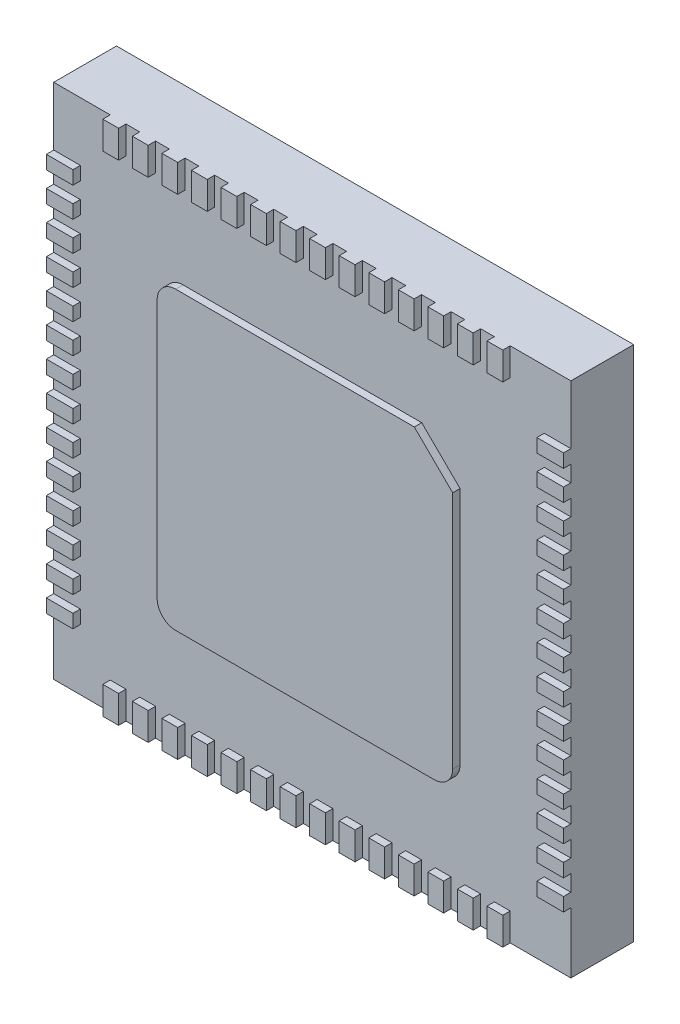
from build123d import *

# Parameters (mm, degrees)
PACKAGE_W               = 7
PACKAGE_H               = 7
BOSS_EXTRU_1_DEPTH      = 0.85
ESQUISSE2_W             = 0.213586618
ESQUISSE2_H             = 0.374942299
ESQUISSE2_W_2           = 0.360094548
ESQUISSE2_H_2           = 0.182510236
ESQUISSE2_W_3           = 0.360094549
BOSS_EXTRU_2_DEPTH      = 0.1
ESQUISSE3_R             = 0.166069215
ENL_V_MAT_EXTRU_1_DEPTH = 0.1
ENL_V_MAT_EXTRU_2_DEPTH = 0.02


with BuildPart() as part:
    # package → Boss.-Extru.1 (new body)
    with BuildSketch(Plane.XY):
        with Locations((26.809198807, 233.44048648)):
            Rectangle(PACKAGE_W, PACKAGE_H)
    extrude(amount=-BOSS_EXTRU_1_DEPTH)

    # Esquisse2 → Boss.-Extru.2 (add)
    with BuildSketch(Plane.XY):
        with BuildLine():
            Line((25.059198807, 231.44048648), (28.559198807, 231.44048648))
            ThreePointArc((28.559198807, 231.44048648), (28.735975502, 231.513709785), (28.809198807, 231.69048648))
            Line((28.809198807, 231.69048648), (28.809198807, 234.928046777))
            Line((28.809198807, 234.928046777), (28.290211106, 235.44048648))
            Line((28.290211106, 235.44048648), (25.059198807, 235.44048648))
            ThreePointArc((25.059198807, 235.44048648), (24.882422111, 235.367263175), (24.809198807, 235.19048648))
            Line((24.809198807, 235.19048648), (24.809198807, 231.69048648))
            ThreePointArc((24.809198807, 231.69048648), (24.882422111, 231.513709785), (25.059198807, 231.44048648))
        make_face()
        with Locations((24.180646365, 236.753015331)):
            Rectangle(ESQUISSE2_W, ESQUISSE2_H)
        with Locations((24.580646365, 236.753015331)):
            Rectangle(ESQUISSE2_W, ESQUISSE2_H)
        with Locations((24.980646365, 236.753015331)):
            Rectangle(ESQUISSE2_W, ESQUISSE2_H)
        with Locations((25.380646365, 236.753015331)):
            Rectangle(ESQUISSE2_W, ESQUISSE2_H)
        with Locations((25.780646365, 236.753015331)):
            Rectangle(ESQUISSE2_W, ESQUISSE2_H)
        with Locations((26.180646365, 236.753015331)):
            Rectangle(ESQUISSE2_W, ESQUISSE2_H)
        with Locations((26.580646365, 236.753015331)):
            Rectangle(ESQUISSE2_W, ESQUISSE2_H)
        with Locations((26.980646365, 236.753015331)):
            Rectangle(ESQUISSE2_W, ESQUISSE2_H)
        with Locations((27.380646365, 236.753015331)):
            Rectangle(ESQUISSE2_W, ESQUISSE2_H)
        with Locations((27.780646365, 236.753015331)):
            Rectangle(ESQUISSE2_W, ESQUISSE2_H)
        with Locations((28.180646365, 236.753015331)):
            Rectangle(ESQUISSE2_W, ESQUISSE2_H)
        with Locations((28.580646365, 236.753015331)):
            Rectangle(ESQUISSE2_W, ESQUISSE2_H)
        with Locations((28.980646365, 236.753015331)):
            Rectangle(ESQUISSE2_W, ESQUISSE2_H)
        with Locations((29.380646365, 236.753015331)):
            Rectangle(ESQUISSE2_W, ESQUISSE2_H)
        with Locations((23.489246081, 235.654646382)):
            Rectangle(ESQUISSE2_W_2, ESQUISSE2_H_2)
        with Locations((23.489246081, 236.054646382)):
            Rectangle(ESQUISSE2_W_2, ESQUISSE2_H_2)
        with Locations((23.489246081, 235.254646382)):
            Rectangle(ESQUISSE2_W_2, ESQUISSE2_H_2)
        with Locations((23.489246081, 234.854646382)):
            Rectangle(ESQUISSE2_W_2, ESQUISSE2_H_2)
        with Locations((23.489246081, 234.454646382)):
            Rectangle(ESQUISSE2_W_2, ESQUISSE2_H_2)
        with Locations((23.489246081, 234.054646382)):
            Rectangle(ESQUISSE2_W_2, ESQUISSE2_H_2)
        with Locations((23.489246081, 233.654646382)):
            Rectangle(ESQUISSE2_W_2, ESQUISSE2_H_2)
        with Locations((23.489246081, 233.254646382)):
            Rectangle(ESQUISSE2_W_2, ESQUISSE2_H_2)
        with Locations((23.489246081, 232.854646382)):
            Rectangle(ESQUISSE2_W_2, ESQUISSE2_H_2)
        with Locations((23.489246081, 232.454646382)):
            Rectangle(ESQUISSE2_W_2, ESQUISSE2_H_2)
        with Locations((23.489246081, 232.054646382)):
            Rectangle(ESQUISSE2_W_2, ESQUISSE2_H_2)
        with Locations((23.489246081, 231.654646382)):
            Rectangle(ESQUISSE2_W_2, ESQUISSE2_H_2)
        with Locations((23.489246081, 231.254646382)):
            Rectangle(ESQUISSE2_W_2, ESQUISSE2_H_2)
        with Locations((23.489246081, 230.854646382)):
            Rectangle(ESQUISSE2_W_2, ESQUISSE2_H_2)
        with Locations((29.380646365, 230.12795763)):
            Rectangle(ESQUISSE2_W, ESQUISSE2_H)
        with Locations((28.980646365, 230.12795763)):
            Rectangle(ESQUISSE2_W, ESQUISSE2_H)
        with Locations((28.580646365, 230.12795763)):
            Rectangle(ESQUISSE2_W, ESQUISSE2_H)
        with Locations((28.180646365, 230.12795763)):
            Rectangle(ESQUISSE2_W, ESQUISSE2_H)
        with Locations((27.780646365, 230.12795763)):
            Rectangle(ESQUISSE2_W, ESQUISSE2_H)
        with Locations((27.380646365, 230.12795763)):
            Rectangle(ESQUISSE2_W, ESQUISSE2_H)
        with Locations((26.980646365, 230.12795763)):
            Rectangle(ESQUISSE2_W, ESQUISSE2_H)
        with Locations((26.580646365, 230.12795763)):
            Rectangle(ESQUISSE2_W, ESQUISSE2_H)
        with Locations((26.180646365, 230.12795763)):
            Rectangle(ESQUISSE2_W, ESQUISSE2_H)
        with Locations((25.780646365, 230.12795763)):
            Rectangle(ESQUISSE2_W, ESQUISSE2_H)
        with Locations((25.380646365, 230.12795763)):
            Rectangle(ESQUISSE2_W, ESQUISSE2_H)
        with Locations((24.980646365, 230.12795763)):
            Rectangle(ESQUISSE2_W, ESQUISSE2_H)
        with Locations((24.580646365, 230.12795763)):
            Rectangle(ESQUISSE2_W, ESQUISSE2_H)
        with Locations((24.180646365, 230.12795763)):
            Rectangle(ESQUISSE2_W, ESQUISSE2_H)
        with Locations((30.129151533, 230.854646382)):
            Rectangle(ESQUISSE2_W_3, ESQUISSE2_H_2)
        with Locations((30.129151533, 231.254646382)):
            Rectangle(ESQUISSE2_W_3, ESQUISSE2_H_2)
        with Locations((30.129151533, 231.654646382)):
            Rectangle(ESQUISSE2_W_3, ESQUISSE2_H_2)
        with Locations((30.129151533, 232.054646382)):
            Rectangle(ESQUISSE2_W_3, ESQUISSE2_H_2)
        with Locations((30.129151533, 232.454646382)):
            Rectangle(ESQUISSE2_W_3, ESQUISSE2_H_2)
        with Locations((30.129151533, 232.854646382)):
            Rectangle(ESQUISSE2_W_3, ESQUISSE2_H_2)
        with Locations((30.129151533, 233.254646382)):
            Rectangle(ESQUISSE2_W_3, ESQUISSE2_H_2)
        with Locations((30.129151533, 233.654646382)):
            Rectangle(ESQUISSE2_W_3, ESQUISSE2_H_2)
        with Locations((30.129151533, 234.054646382)):
            Rectangle(ESQUISSE2_W_3, ESQUISSE2_H_2)
        with Locations((30.129151533, 234.454646382)):
            Rectangle(ESQUISSE2_W_3, ESQUISSE2_H_2)
        with Locations((30.129151533, 234.854646382)):
            Rectangle(ESQUISSE2_W_3, ESQUISSE2_H_2)
        with Locations((30.129151533, 235.254646382)):
            Rectangle(ESQUISSE2_W_3, ESQUISSE2_H_2)
        with Locations((30.129151533, 235.654646382)):
            Rectangle(ESQUISSE2_W_3, ESQUISSE2_H_2)
        with Locations((30.129151533, 236.054646382)):
            Rectangle(ESQUISSE2_W_3, ESQUISSE2_H_2)
    extrude(amount=BOSS_EXTRU_2_DEPTH)

    # Esquisse3 → Enlèv. mat.-Extru.1 (cut)
    with BuildSketch(Plane(origin=(0, 0, -0.85), x_dir=(-1, 0, 0), z_dir=(0, 0, -1))):
        with Locations((-29.974611492, 236.581266458)):
            Circle(ESQUISSE3_R)
    extrude(amount=-ENL_V_MAT_EXTRU_1_DEPTH, mode=Mode.SUBTRACT)

    # Esquisse4 → Enlèv. mat.-Extru.2 (cut)
    # profile 1 of 12: a face of its own
    with BuildSketch(Plane(origin=(-0.370356703, 1.102355834, -0.85), x_dir=(-1, 0, 0), z_dir=(0, 0, -1))):
        Polygon((-28.682895901, 230.452000635), (-28.686659901, 230.484713635), (-28.838331901, 230.480821635), (-28.990003901, 230.476927635), (-28.990003901, 230.596414635), (-28.990003901, 230.715902635), (-28.856175901, 230.719267635), (-28.722347901, 230.722633635), (-28.722347901, 230.752370635), (-28.722347901, 230.782109635), (-28.856175901, 230.785472635), (-28.990003901, 230.788837635), (-28.990003901, 230.901457635), (-28.990003901, 231.014078635), (-28.841305901, 231.014078635), (-28.692607901, 231.014078635), (-28.692607901, 231.043818635), (-28.692607901, 231.073557635), (-28.876993901, 231.073557635), (-29.061378901, 231.073557635), (-29.061378901, 230.746422635), (-29.061378901, 230.419287635), (-28.870255901, 230.419287635), (-28.679131901, 230.419287635), align=None)
    # profile 2 of 12: a face of its own
    with BuildSketch(Plane(origin=(-0.370356703, 1.102355834, -0.85), x_dir=(-1, 0, 0), z_dir=(0, 0, -1))):
        with BuildLine():
            Line((-28.038336901, 230.556089635), (-28.038336901, 230.692890635))
            Line((-28.038336901, 230.692890635), (-27.936045901, 230.692890635))
            add(Edge.make_bspline(
                [(-27.936045901, 230.692890635), (-27.765671901, 230.692890635), (-27.699306901, 230.744596635), (-27.699384901, 230.877275635)],
                knots=[0, 0, 0, 0, 1, 1, 1, 1], degree=3))
            add(Edge.make_bspline(
                [(-27.699384901, 230.877275635), (-27.699473901, 230.963355635), (-27.727885901, 231.019005635), (-27.788523901, 231.051635635)],
                knots=[0, 0, 0, 0, 1, 1, 1, 1], degree=3))
            add(Edge.make_bspline(
                [(-27.788523901, 231.051635635), (-27.823602901, 231.070510635), (-27.851561901, 231.073534635), (-27.966063901, 231.070822635)],
                knots=[0, 0, 0, 0, 1, 1, 1, 1], degree=3))
            Line((-27.966063901, 231.070822635), (-28.101966901, 231.067608635))
            Line((-28.101966901, 231.067608635), (-28.099929901, 230.746420635))
            add(Edge.make_bspline(
                [(-28.099929901, 230.746420635), (-28.098817901, 230.569767635), (-28.097865901, 230.423895635), (-28.097865901, 230.422259635)],
                knots=[0, 0, 0, 0, 1, 1, 1, 1], degree=3))
            add(Edge.make_bspline(
                [(-28.097865901, 230.422259635), (-28.097865901, 230.420618635), (-28.084442901, 230.419285635), (-28.068085901, 230.419285635)],
                knots=[0, 0, 0, 0, 1, 1, 1, 1], degree=3))
            Line((-28.068085901, 230.419285635), (-28.038346901, 230.419285635))
            Line((-28.038346901, 230.419285635), (-28.038336901, 230.556089635))
        make_face()
        with BuildLine():
            Line((-28.038336901, 230.883224635), (-28.038336901, 231.014076635))
            Line((-28.038336901, 231.014076635), (-27.948527901, 231.014076635))
            add(Edge.make_bspline(
                [(-27.948527901, 231.014076635), (-27.816620901, 231.014076635), (-27.764732901, 230.977134635), (-27.764732901, 230.883222635)],
                knots=[0, 0, 0, 0, 1, 1, 1, 1], degree=3))
            add(Edge.make_bspline(
                [(-27.764732901, 230.883222635), (-27.764732901, 230.789310635), (-27.816620901, 230.752368635), (-27.948527901, 230.752368635)],
                knots=[0, 0, 0, 0, 1, 1, 1, 1], degree=3))
            Line((-27.948527901, 230.752368635), (-28.038336901, 230.752368635))
            Line((-28.038336901, 230.752368635), (-28.038336901, 230.883224635))
        make_face(mode=Mode.SUBTRACT)
    # profile 3 of 12: a face of its own
    with BuildSketch(Plane(origin=(-0.370356703, 1.102355834, -0.85), x_dir=(-1, 0, 0), z_dir=(0, 0, -1))):
        with BuildLine():
            Line((-26.848753901, 230.452550635), (-26.848753901, 230.485813635))
            Line((-26.848753901, 230.485813635), (-26.961421901, 230.480884635))
            add(Edge.make_bspline(
                [(-26.961421901, 230.480884635), (-27.105904901, 230.474566635), (-27.117372901, 230.478476635), (-27.092930901, 230.525741635)],
                knots=[0, 0, 0, 0, 1, 1, 1, 1], degree=3))
            add(Edge.make_bspline(
                [(-27.092930901, 230.525741635), (-27.082831901, 230.545270635), (-27.034841901, 230.603731635), (-26.986284901, 230.655653635)],
                knots=[0, 0, 0, 0, 1, 1, 1, 1], degree=3))
            add(Edge.make_bspline(
                [(-26.986284901, 230.655653635), (-26.937727901, 230.707574635), (-26.886919901, 230.771775635), (-26.873377901, 230.798321635)],
                knots=[0, 0, 0, 0, 1, 1, 1, 1], degree=3))
            add(Edge.make_bspline(
                [(-26.873377901, 230.798321635), (-26.839982901, 230.863779635), (-26.840408901, 230.956132635), (-26.874382901, 231.011063635)],
                knots=[0, 0, 0, 0, 1, 1, 1, 1], degree=3))
            add(Edge.make_bspline(
                [(-26.874382901, 231.011063635), (-26.934701901, 231.108662635), (-27.096131901, 231.109470635), (-27.154897901, 231.012466635)],
                knots=[0, 0, 0, 0, 1, 1, 1, 1], degree=3))
            add(Edge.make_bspline(
                [(-27.154897901, 231.012466635), (-27.194417901, 230.947235635), (-27.198240901, 230.922146635), (-27.170894901, 230.907510635)],
                knots=[0, 0, 0, 0, 1, 1, 1, 1], degree=3))
            add(Edge.make_bspline(
                [(-27.170894901, 230.907510635), (-27.149762901, 230.896199635), (-27.143994901, 230.900337635), (-27.122700901, 230.942075635)],
                knots=[0, 0, 0, 0, 1, 1, 1, 1], degree=3))
            add(Edge.make_bspline(
                [(-27.122700901, 230.942075635), (-27.095079901, 230.996219635), (-27.068447901, 231.014075635), (-27.015319901, 231.014075635)],
                knots=[0, 0, 0, 0, 1, 1, 1, 1], degree=3))
            add(Edge.make_bspline(
                [(-27.015319901, 231.014075635), (-26.961995901, 231.014075635), (-26.935881901, 230.996306635), (-26.920438901, 230.949514635)],
                knots=[0, 0, 0, 0, 1, 1, 1, 1], degree=3))
            add(Edge.make_bspline(
                [(-26.920438901, 230.949514635), (-26.896851901, 230.878039635), (-26.921073901, 230.824643635), (-27.035422901, 230.695952635)],
                knots=[0, 0, 0, 0, 1, 1, 1, 1], degree=3))
            add(Edge.make_bspline(
                [(-27.035422901, 230.695952635), (-27.131392901, 230.587953635), (-27.193375901, 230.487724635), (-27.193640901, 230.440101635)],
                knots=[0, 0, 0, 0, 1, 1, 1, 1], degree=3))
            add(Edge.make_bspline(
                [(-27.193640901, 230.440101635), (-27.193748901, 230.421226635), (-27.177657901, 230.419284635), (-27.021267901, 230.419284635)],
                knots=[0, 0, 0, 0, 1, 1, 1, 1], degree=3))
            Line((-27.021267901, 230.419284635), (-26.848778901, 230.419284635))
            Line((-26.848778901, 230.419284635), (-26.848753901, 230.452550635))
        make_face()
    # profile 4 of 12: a face of its own
    with BuildSketch(Plane(origin=(-0.370356703, 1.102355834, -0.85), x_dir=(-1, 0, 0), z_dir=(0, 0, -1))):
        with BuildLine():
            Line((-26.398895901, 230.745900635), (-26.395130901, 230.776160635))
            Line((-26.395130901, 230.776160635), (-26.580305901, 230.776160635))
            Line((-26.580305901, 230.776160635), (-26.765481901, 230.776160635))
            Line((-26.765481901, 230.776160635), (-26.765481901, 230.748404635))
            add(Edge.make_bspline(
                [(-26.765481901, 230.748404635), (-26.765481901, 230.733137635), (-26.763258901, 230.718416635), (-26.760541901, 230.715690635)],
                knots=[0, 0, 0, 0, 1, 1, 1, 1], degree=3))
            add(Edge.make_bspline(
                [(-26.760541901, 230.715690635), (-26.757826901, 230.712965635), (-26.676189901, 230.711838635), (-26.579129901, 230.713203635)],
                knots=[0, 0, 0, 0, 1, 1, 1, 1], degree=3))
            Line((-26.579129901, 230.713203635), (-26.402658901, 230.715637635))
            Line((-26.402658901, 230.715637635), (-26.398895901, 230.745900635))
        make_face()
    # profile 5 of 12: a face of its own
    with BuildSketch(Plane(origin=(-0.370356703, 1.102355834, -0.85), x_dir=(-1, 0, 0), z_dir=(0, 0, -1))):
        with BuildLine():
            Line((-26.243941901, 232.183604635), (-26.216079901, 232.213479635))
            Line((-26.216079901, 232.213479635), (-26.251178901, 232.250206635))
            add(Edge.make_bspline(
                [(-26.251178901, 232.250206635), (-26.270482901, 232.270407635), (-26.289436901, 232.286933635), (-26.293297901, 232.286933635)],
                knots=[0, 0, 0, 0, 1, 1, 1, 1], degree=3))
            add(Edge.make_bspline(
                [(-26.293297901, 232.286933635), (-26.297160901, 232.286933635), (-26.315316901, 232.272863635), (-26.333645901, 232.255665635)],
                knots=[0, 0, 0, 0, 1, 1, 1, 1], degree=3))
            add(Edge.make_bspline(
                [(-26.333645901, 232.255665635), (-26.469469901, 232.128229635), (-26.682085901, 232.011372635), (-26.872544901, 231.959478635)],
                knots=[0, 0, 0, 0, 1, 1, 1, 1], degree=3))
            add(Edge.make_bspline(
                [(-26.872544901, 231.959478635), (-27.012691901, 231.921293635), (-27.227176901, 231.908300635), (-27.373231901, 231.929148635)],
                knots=[0, 0, 0, 0, 1, 1, 1, 1], degree=3))
            add(Edge.make_bspline(
                [(-27.373231901, 231.929148635), (-27.600369901, 231.961569635), (-27.859466901, 232.079457635), (-28.026440901, 232.226355635)],
                knots=[0, 0, 0, 0, 1, 1, 1, 1], degree=3))
            add(Edge.make_bspline(
                [(-28.026440901, 232.226355635), (-28.067554901, 232.262525635), (-28.067628901, 232.262762635), (-28.032388901, 232.245294635)],
                knots=[0, 0, 0, 0, 1, 1, 1, 1], degree=3))
            add(Edge.make_bspline(
                [(-28.032388901, 232.245294635), (-27.934855901, 232.196943635), (-27.802320901, 232.249781635), (-27.757320901, 232.354954635)],
                knots=[0, 0, 0, 0, 1, 1, 1, 1], degree=3))
            add(Edge.make_bspline(
                [(-27.757320901, 232.354954635), (-27.736037901, 232.404693635), (-27.736428901, 232.481619635), (-27.758193901, 232.523676635)],
                knots=[0, 0, 0, 0, 1, 1, 1, 1], degree=3))
            add(Edge.make_bspline(
                [(-27.758193901, 232.523676635), (-27.782659901, 232.570993635), (-27.851565901, 232.628189635), (-27.895811901, 232.637907635)],
                knots=[0, 0, 0, 0, 1, 1, 1, 1], degree=3))
            add(Edge.make_bspline(
                [(-27.895811901, 232.637907635), (-28.063272901, 232.674687635), (-28.196784901, 232.518418635), (-28.139774901, 232.352360635)],
                knots=[0, 0, 0, 0, 1, 1, 1, 1], degree=3))
            add(Edge.make_bspline(
                [(-28.139774901, 232.352360635), (-28.121341901, 232.298669635), (-28.253070901, 232.473935635), (-28.314120901, 232.584329635)],
                knots=[0, 0, 0, 0, 1, 1, 1, 1], degree=3))
            add(Edge.make_bspline(
                [(-28.314120901, 232.584329635), (-28.358995901, 232.665473635), (-28.417219901, 232.824067635), (-28.437529901, 232.920475635)],
                knots=[0, 0, 0, 0, 1, 1, 1, 1], degree=3))
            add(Edge.make_bspline(
                [(-28.437529901, 232.920475635), (-28.519806901, 233.311033635), (-28.410471901, 233.733223635), (-28.152908901, 234.019525635)],
                knots=[0, 0, 0, 0, 1, 1, 1, 1], degree=3))
            add(Edge.make_bspline(
                [(-28.152908901, 234.019525635), (-28.122613901, 234.053199635), (-28.097827901, 234.084392635), (-28.097827901, 234.088841635)],
                knots=[0, 0, 0, 0, 1, 1, 1, 1], degree=3))
            add(Edge.make_bspline(
                [(-28.097827901, 234.088841635), (-28.097827901, 234.093290635), (-28.114613901, 234.113715635), (-28.135128901, 234.134231635)],
                knots=[0, 0, 0, 0, 1, 1, 1, 1], degree=3))
            Line((-28.135128901, 234.134231635), (-28.172418901, 234.171531635))
            Line((-28.172418901, 234.171531635), (-28.231580901, 234.106550635))
            add(Edge.make_bspline(
                [(-28.231580901, 234.106550635), (-28.394784901, 233.927291635), (-28.516620901, 233.673347635), (-28.562390901, 233.417037635)],
                knots=[0, 0, 0, 0, 1, 1, 1, 1], degree=3))
            add(Edge.make_bspline(
                [(-28.562390901, 233.417037635), (-28.582101901, 233.306659635), (-28.578760901, 233.036879635), (-28.556352901, 232.929308635)],
                knots=[0, 0, 0, 0, 1, 1, 1, 1], degree=3))
            add(Edge.make_bspline(
                [(-28.556352901, 232.929308635), (-28.430736901, 232.326329635), (-27.974202901, 231.896504635), (-27.368563901, 231.811008635)],
                knots=[0, 0, 0, 0, 1, 1, 1, 1], degree=3))
            add(Edge.make_bspline(
                [(-27.368563901, 231.811008635), (-27.254207901, 231.794863635), (-27.035359901, 231.806044635), (-26.904539901, 231.834714635)],
                knots=[0, 0, 0, 0, 1, 1, 1, 1], degree=3))
            add(Edge.make_bspline(
                [(-26.904539901, 231.834714635), (-26.738693901, 231.871060635), (-26.604921901, 231.925152635), (-26.456190901, 232.016007635)],
                knots=[0, 0, 0, 0, 1, 1, 1, 1], degree=3))
            add(Edge.make_bspline(
                [(-26.456190901, 232.016007635), (-26.400996901, 232.049724635), (-26.278850901, 232.146173635), (-26.243941901, 232.183604635)],
                knots=[0, 0, 0, 0, 1, 1, 1, 1], degree=3))
        make_face()
    # profile 6 of 12: a face of its own
    with BuildSketch(Plane(origin=(-0.370356703, 1.102355834, -0.85), x_dir=(-1, 0, 0), z_dir=(0, 0, -1))):
        with BuildLine():
            Line((-26.988920901, 232.067859635), (-26.897118901, 232.035865635))
            Line((-26.897118901, 232.035865635), (-26.801272901, 232.069009635))
            add(Edge.make_bspline(
                [(-26.801272901, 232.069009635), (-26.711475901, 232.100061635), (-26.704722901, 232.104795635), (-26.694277901, 232.143987635)],
                knots=[0, 0, 0, 0, 1, 1, 1, 1], degree=3))
            add(Edge.make_bspline(
                [(-26.694277901, 232.143987635), (-26.615948901, 232.437908635), (-26.677391901, 232.827784635), (-26.844262901, 233.095688635)],
                knots=[0, 0, 0, 0, 1, 1, 1, 1], degree=3))
            add(Edge.make_bspline(
                [(-26.844262901, 233.095688635), (-27.062930901, 233.446758635), (-27.361565901, 233.645788635), (-27.765689901, 233.709795635)],
                knots=[0, 0, 0, 0, 1, 1, 1, 1], degree=3))
            add(Edge.make_bspline(
                [(-27.765689901, 233.709795635), (-27.917309901, 233.733809635), (-28.009677901, 233.725095635), (-28.111372901, 233.677184635)],
                knots=[0, 0, 0, 0, 1, 1, 1, 1], degree=3))
            add(Edge.make_bspline(
                [(-28.111372901, 233.677184635), (-28.285127901, 233.595324635), (-28.366557901, 233.452932635), (-28.357725901, 233.246396635)],
                knots=[0, 0, 0, 0, 1, 1, 1, 1], degree=3))
            add(Edge.make_bspline(
                [(-28.357725901, 233.246396635), (-28.352688901, 233.128611635), (-28.316381901, 233.045203635), (-28.234506901, 232.963328635)],
                knots=[0, 0, 0, 0, 1, 1, 1, 1], degree=3))
            add(Edge.make_bspline(
                [(-28.234506901, 232.963328635), (-28.158198901, 232.887020635), (-28.074743901, 232.847834635), (-27.960330901, 232.834591635)],
                knots=[0, 0, 0, 0, 1, 1, 1, 1], degree=3))
            add(Edge.make_bspline(
                [(-27.960330901, 232.834591635), (-27.812487901, 232.817478635), (-27.740352901, 232.784897635), (-27.649779901, 232.694325635)],
                knots=[0, 0, 0, 0, 1, 1, 1, 1], degree=3))
            add(Edge.make_bspline(
                [(-27.649779901, 232.694325635), (-27.554761901, 232.599307635), (-27.526128901, 232.401900635), (-27.588964901, 232.275047635)],
                knots=[0, 0, 0, 0, 1, 1, 1, 1], degree=3))
            add(Edge.make_bspline(
                [(-27.588964901, 232.275047635), (-27.606792901, 232.239062635), (-27.628202901, 232.200098635), (-27.636548901, 232.188460635)],
                knots=[0, 0, 0, 0, 1, 1, 1, 1], degree=3))
            add(Edge.make_bspline(
                [(-27.636548901, 232.188460635), (-27.649923901, 232.169807635), (-27.643414901, 232.159943635), (-27.581579901, 232.105189635)],
                knots=[0, 0, 0, 0, 1, 1, 1, 1], degree=3))
            add(Edge.make_bspline(
                [(-27.581579901, 232.105189635), (-27.519765901, 232.050454635), (-27.500692901, 232.040760635), (-27.420985901, 232.023562635)],
                knots=[0, 0, 0, 0, 1, 1, 1, 1], degree=3))
            add(Edge.make_bspline(
                [(-27.420985901, 232.023562635), (-27.371237901, 232.012827635), (-27.324590901, 232.003459635), (-27.317323901, 232.002744635)],
                knots=[0, 0, 0, 0, 1, 1, 1, 1], degree=3))
            add(Edge.make_bspline(
                [(-27.317323901, 232.002744635), (-27.310057901, 232.002030635), (-27.287791901, 232.032223635), (-27.267847901, 232.069844635)],
                knots=[0, 0, 0, 0, 1, 1, 1, 1], degree=3))
            add(Edge.make_bspline(
                [(-27.267847901, 232.069844635), (-27.203229901, 232.191714635), (-27.176485901, 232.301219635), (-27.177056901, 232.441579635)],
                knots=[0, 0, 0, 0, 1, 1, 1, 1], degree=3))
            add(Edge.make_bspline(
                [(-27.177056901, 232.441579635), (-27.177611901, 232.578706635), (-27.196844901, 232.663001635), (-27.252911901, 232.774069635)],
                knots=[0, 0, 0, 0, 1, 1, 1, 1], degree=3))
            add(Edge.make_bspline(
                [(-27.252911901, 232.774069635), (-27.379430901, 233.024700635), (-27.598237901, 233.172153635), (-27.898785901, 233.209319635)],
                knots=[0, 0, 0, 0, 1, 1, 1, 1], degree=3))
            add(Edge.make_bspline(
                [(-27.898785901, 233.209319635), (-27.990144901, 233.220616635), (-28.020079901, 233.295789635), (-27.948481901, 233.334108635)],
                knots=[0, 0, 0, 0, 1, 1, 1, 1], degree=3))
            add(Edge.make_bspline(
                [(-27.948481901, 233.334108635), (-27.923583901, 233.347432635), (-27.902936901, 233.347556635), (-27.826745901, 233.334848635)],
                knots=[0, 0, 0, 0, 1, 1, 1, 1], degree=3))
            add(Edge.make_bspline(
                [(-27.826745901, 233.334848635), (-27.510508901, 233.282091635), (-27.270265901, 233.109019635), (-27.139966901, 232.840091635)],
                knots=[0, 0, 0, 0, 1, 1, 1, 1], degree=3))
            add(Edge.make_bspline(
                [(-27.139966901, 232.840091635), (-27.059856901, 232.674749635), (-27.045239901, 232.607155635), (-27.046074901, 232.405893635)],
                knots=[0, 0, 0, 0, 1, 1, 1, 1], degree=3))
            add(Edge.make_bspline(
                [(-27.046074901, 232.405893635), (-27.046709901, 232.254406635), (-27.049990901, 232.226284635), (-27.073096901, 232.174937635)],
                knots=[0, 0, 0, 0, 1, 1, 1, 1], degree=3))
            add(Edge.make_bspline(
                [(-27.073096901, 232.174937635), (-27.087566901, 232.142781635), (-27.095197901, 232.112731635), (-27.090061901, 232.108162635)],
                knots=[0, 0, 0, 0, 1, 1, 1, 1], degree=3))
            add(Edge.make_bspline(
                [(-27.090061901, 232.108162635), (-27.084925901, 232.103592635), (-27.039411901, 232.085455635), (-26.988920901, 232.067859635)],
                knots=[0, 0, 0, 0, 1, 1, 1, 1], degree=3))
        make_face()
    # profile 7 of 12: a face of its own
    with BuildSketch(Plane(origin=(-0.370356703, 1.102355834, -0.85), x_dir=(-1, 0, 0), z_dir=(0, 0, -1))):
        with BuildLine():
            Line((-26.200308901, 232.581385635), (-26.157213901, 232.643867635))
            Line((-26.157213901, 232.643867635), (-26.182079901, 232.768935635))
            add(Edge.make_bspline(
                [(-26.182079901, 232.768935635), (-26.256280901, 233.142099635), (-26.416912901, 233.451646635), (-26.663512901, 233.696686635)],
                knots=[0, 0, 0, 0, 1, 1, 1, 1], degree=3))
            add(Edge.make_bspline(
                [(-26.663512901, 233.696686635), (-26.925578901, 233.957094635), (-27.245255901, 234.129705635), (-27.600755901, 234.202754635)],
                knots=[0, 0, 0, 0, 1, 1, 1, 1], degree=3))
            Line((-27.600755901, 234.202754635), (-27.711200901, 234.225449635))
            Line((-27.711200901, 234.225449635), (-27.803997901, 234.169438635))
            add(Edge.make_bspline(
                [(-27.803997901, 234.169438635), (-27.855035901, 234.138632635), (-27.915473901, 234.098030635), (-27.938303901, 234.079212635)],
                knots=[0, 0, 0, 0, 1, 1, 1, 1], degree=3))
            Line((-27.938303901, 234.079212635), (-27.979812901, 234.044996635))
            Line((-27.979812901, 234.044996635), (-27.976359901, 233.954063635))
            Line((-27.976359901, 233.954063635), (-27.972909901, 233.863131635))
            Line((-27.972909901, 233.863131635), (-27.931273901, 233.860211635))
            add(Edge.make_bspline(
                [(-27.931273901, 233.860211635), (-27.689406901, 233.843249635), (-27.524540901, 233.802663635), (-27.339541901, 233.714538635)],
                knots=[0, 0, 0, 0, 1, 1, 1, 1], degree=3))
            add(Edge.make_bspline(
                [(-27.339541901, 233.714538635), (-26.903911901, 233.507024635), (-26.617007901, 233.121080635), (-26.545849901, 232.646860635)],
                knots=[0, 0, 0, 0, 1, 1, 1, 1], degree=3))
            add(Edge.make_bspline(
                [(-26.545849901, 232.646860635), (-26.535795901, 232.579840635), (-26.527567901, 232.498205635), (-26.527567901, 232.465448635)],
                knots=[0, 0, 0, 0, 1, 1, 1, 1], degree=3))
            Line((-26.527567901, 232.465448635), (-26.527567901, 232.405891635))
            Line((-26.527567901, 232.405891635), (-26.423478901, 232.406104635))
            Line((-26.423478901, 232.406104635), (-26.319389901, 232.406318635))
            Line((-26.319389901, 232.406318635), (-26.281397901, 232.462610635))
            add(Edge.make_bspline(
                [(-26.281397901, 232.462610635), (-26.260501901, 232.493571635), (-26.224011901, 232.547019635), (-26.200308901, 232.581385635)],
                knots=[0, 0, 0, 0, 1, 1, 1, 1], degree=3))
        make_face()
    # profile 8 of 12: a face of its own
    with BuildSketch(Plane(origin=(-0.370356703, 1.102355834, -0.85), x_dir=(-1, 0, 0), z_dir=(0, 0, -1))):
        with BuildLine():
            Line((-27.182201901, 234.356622635), (-27.295578901, 234.356814635))
            Line((-27.295578901, 234.356814635), (-27.309709901, 234.319383635))
            add(Edge.make_bspline(
                [(-27.309709901, 234.319383635), (-27.327103901, 234.273295635), (-27.323478901, 234.267053635), (-27.268846901, 234.249022635)],
                knots=[0, 0, 0, 0, 1, 1, 1, 1], degree=3))
            add(Edge.make_bspline(
                [(-27.268846901, 234.249022635), (-27.189405901, 234.222804635), (-26.999038901, 234.128416635), (-26.914384901, 234.073271635)],
                knots=[0, 0, 0, 0, 1, 1, 1, 1], degree=3))
            add(Edge.make_bspline(
                [(-26.914384901, 234.073271635), (-26.792558901, 233.993914635), (-26.623325901, 233.856012635), (-26.548253901, 233.774925635)],
                knots=[0, 0, 0, 0, 1, 1, 1, 1], degree=3))
            add(Edge.make_bspline(
                [(-26.548253901, 233.774925635), (-26.427699901, 233.644714635), (-26.306354901, 233.470627635), (-26.227655901, 233.314985635)],
                knots=[0, 0, 0, 0, 1, 1, 1, 1], degree=3))
            add(Edge.make_bspline(
                [(-26.227655901, 233.314985635), (-26.184910901, 233.230449635), (-26.143485901, 233.141208635), (-26.135600901, 233.116673635)],
                knots=[0, 0, 0, 0, 1, 1, 1, 1], degree=3))
            add(Edge.make_bspline(
                [(-26.135600901, 233.116673635), (-26.120434901, 233.069481635), (-26.096120901, 233.060205635), (-26.050952901, 233.084378635)],
                knots=[0, 0, 0, 0, 1, 1, 1, 1], degree=3))
            add(Edge.make_bspline(
                [(-26.050952901, 233.084378635), (-26.030579901, 233.095274635), (-26.027939901, 233.110196635), (-26.027939901, 233.214449635)],
                knots=[0, 0, 0, 0, 1, 1, 1, 1], degree=3))
            add(Edge.make_bspline(
                [(-26.027939901, 233.214449635), (-26.027939901, 233.518850635), (-26.162504901, 233.818680635), (-26.399306901, 234.041908635)],
                knots=[0, 0, 0, 0, 1, 1, 1, 1], degree=3))
            add(Edge.make_bspline(
                [(-26.399306901, 234.041908635), (-26.614220901, 234.244502635), (-26.891948901, 234.356145635), (-27.182201901, 234.356622635)],
                knots=[0, 0, 0, 0, 1, 1, 1, 1], degree=3))
        make_face()
    # profile 9 of 12: a face of its own
    with BuildSketch(Plane(origin=(-0.370356703, 1.102355834, -0.85), x_dir=(-1, 0, 0), z_dir=(0, 0, -1))):
        with BuildLine():
            add(Edge.make_bspline(
                [(-28.303410901, 230.427253635), (-28.243523901, 230.455675635), (-28.216872901, 230.505825635), (-28.216818901, 230.590201635)],
                knots=[0, 0, 0, 0, 1, 1, 1, 1], degree=3))
            add(Edge.make_bspline(
                [(-28.216818901, 230.590201635), (-28.216818901, 230.655069635), (-28.219926901, 230.663137635), (-28.261383901, 230.704361635)],
                knots=[0, 0, 0, 0, 1, 1, 1, 1], degree=3))
            add(Edge.make_bspline(
                [(-28.261383901, 230.704361635), (-28.288274901, 230.731101635), (-28.334342901, 230.758928635), (-28.377367901, 230.774420635)],
                knots=[0, 0, 0, 0, 1, 1, 1, 1], degree=3))
            add(Edge.make_bspline(
                [(-28.377367901, 230.774420635), (-28.470083901, 230.807804635), (-28.503146901, 230.827086635), (-28.531048901, 230.864044635)],
                knots=[0, 0, 0, 0, 1, 1, 1, 1], degree=3))
            add(Edge.make_bspline(
                [(-28.531048901, 230.864044635), (-28.550946901, 230.890399635), (-28.552111901, 230.900170635), (-28.540118901, 230.940193635)],
                knots=[0, 0, 0, 0, 1, 1, 1, 1], degree=3))
            add(Edge.make_bspline(
                [(-28.540118901, 230.940193635), (-28.513224901, 231.029958635), (-28.383243901, 231.048341635), (-28.311957901, 230.972460635)],
                knots=[0, 0, 0, 0, 1, 1, 1, 1], degree=3))
            add(Edge.make_bspline(
                [(-28.311957901, 230.972460635), (-28.282086901, 230.940664635), (-28.268142901, 230.936903635), (-28.241853901, 230.953550635)],
                knots=[0, 0, 0, 0, 1, 1, 1, 1], degree=3))
            add(Edge.make_bspline(
                [(-28.241853901, 230.953550635), (-28.216505901, 230.969603635), (-28.269018901, 231.035724635), (-28.328606901, 231.062786635)],
                knots=[0, 0, 0, 0, 1, 1, 1, 1], degree=3))
            add(Edge.make_bspline(
                [(-28.328606901, 231.062786635), (-28.415920901, 231.102439635), (-28.515849901, 231.084037635), (-28.574219901, 231.017557635)],
                knots=[0, 0, 0, 0, 1, 1, 1, 1], degree=3))
            add(Edge.make_bspline(
                [(-28.574219901, 231.017557635), (-28.603889901, 230.983765635), (-28.609335901, 230.967543635), (-28.609335901, 230.912963635)],
                knots=[0, 0, 0, 0, 1, 1, 1, 1], degree=3))
            add(Edge.make_bspline(
                [(-28.609335901, 230.912963635), (-28.609335901, 230.858388635), (-28.603888901, 230.842159635), (-28.574234901, 230.808385635)],
                knots=[0, 0, 0, 0, 1, 1, 1, 1], degree=3))
            add(Edge.make_bspline(
                [(-28.574234901, 230.808385635), (-28.554927901, 230.786398635), (-28.516118901, 230.758625635), (-28.487989901, 230.746670635)],
                knots=[0, 0, 0, 0, 1, 1, 1, 1], degree=3))
            add(Edge.make_bspline(
                [(-28.487989901, 230.746670635), (-28.318359901, 230.674574635), (-28.311229901, 230.670302635), (-28.294767901, 230.630904635)],
                knots=[0, 0, 0, 0, 1, 1, 1, 1], degree=3))
            add(Edge.make_bspline(
                [(-28.294767901, 230.630904635), (-28.272606901, 230.577866635), (-28.283673901, 230.532228635), (-28.327672901, 230.495206635)],
                knots=[0, 0, 0, 0, 1, 1, 1, 1], degree=3))
            add(Edge.make_bspline(
                [(-28.327672901, 230.495206635), (-28.359812901, 230.468162635), (-28.372443901, 230.464994635), (-28.429334901, 230.469711635)],
                knots=[0, 0, 0, 0, 1, 1, 1, 1], degree=3))
            add(Edge.make_bspline(
                [(-28.429334901, 230.469711635), (-28.486014901, 230.474412635), (-28.499527901, 230.480805635), (-28.535320901, 230.519862635)],
                knots=[0, 0, 0, 0, 1, 1, 1, 1], degree=3))
            add(Edge.make_bspline(
                [(-28.535320901, 230.519862635), (-28.571735901, 230.559597635), (-28.579532901, 230.563173635), (-28.604735901, 230.551689635)],
                knots=[0, 0, 0, 0, 1, 1, 1, 1], degree=3))
            add(Edge.make_bspline(
                [(-28.604735901, 230.551689635), (-28.638485901, 230.536312635), (-28.639273901, 230.528708635), (-28.610663901, 230.494445635)],
                knots=[0, 0, 0, 0, 1, 1, 1, 1], degree=3))
            add(Edge.make_bspline(
                [(-28.610663901, 230.494445635), (-28.559959901, 230.433721635), (-28.502927901, 230.407388635), (-28.422113901, 230.407388635)],
                knots=[0, 0, 0, 0, 1, 1, 1, 1], degree=3))
            add(Edge.make_bspline(
                [(-28.422113901, 230.407388635), (-28.374979901, 230.407388635), (-28.329090901, 230.415069635), (-28.303410901, 230.427253635)],
                knots=[0, 0, 0, 0, 1, 1, 1, 1], degree=3))
        make_face()
    # profile 10 of 12: a face of its own
    with BuildSketch(Plane(origin=(-0.370356703, 1.102355834, -0.85), x_dir=(-1, 0, 0), z_dir=(0, 0, -1))):
        with BuildLine():
            add(Edge.make_bspline(
                [(-27.347163901, 230.434397635), (-27.287024901, 230.474569635), (-27.262877901, 230.529830635), (-27.268344901, 230.614767635)],
                knots=[0, 0, 0, 0, 1, 1, 1, 1], degree=3))
            add(Edge.make_bspline(
                [(-27.268344901, 230.614767635), (-27.272562901, 230.680280635), (-27.276451901, 230.688504635), (-27.322595901, 230.729453635)],
                knots=[0, 0, 0, 0, 1, 1, 1, 1], degree=3))
            add(Edge.make_bspline(
                [(-27.322595901, 230.729453635), (-27.359912901, 230.762569635), (-27.367855901, 230.775272635), (-27.354461901, 230.780412635)],
                knots=[0, 0, 0, 0, 1, 1, 1, 1], degree=3))
            add(Edge.make_bspline(
                [(-27.354461901, 230.780412635), (-27.324495901, 230.791910635), (-27.288990901, 230.862768635), (-27.288943901, 230.911166635)],
                knots=[0, 0, 0, 0, 1, 1, 1, 1], degree=3))
            add(Edge.make_bspline(
                [(-27.288943901, 230.911166635), (-27.288854901, 230.978662635), (-27.320518901, 231.035312635), (-27.373332901, 231.062255635)],
                knots=[0, 0, 0, 0, 1, 1, 1, 1], degree=3))
            add(Edge.make_bspline(
                [(-27.373332901, 231.062255635), (-27.456159901, 231.104511635), (-27.533694901, 231.085948635), (-27.591627901, 231.009994635)],
                knots=[0, 0, 0, 0, 1, 1, 1, 1], degree=3))
            add(Edge.make_bspline(
                [(-27.591627901, 231.009994635), (-27.628107901, 230.962167635), (-27.629401901, 230.947511635), (-27.598599901, 230.931026635)],
                knots=[0, 0, 0, 0, 1, 1, 1, 1], degree=3))
            add(Edge.make_bspline(
                [(-27.598599901, 230.931026635), (-27.578684901, 230.920366635), (-27.572398901, 230.923962635), (-27.556193901, 230.955299635)],
                knots=[0, 0, 0, 0, 1, 1, 1, 1], degree=3))
            add(Edge.make_bspline(
                [(-27.556193901, 230.955299635), (-27.501618901, 231.060837635), (-27.360274901, 231.024457635), (-27.360274901, 230.904873635)],
                knots=[0, 0, 0, 0, 1, 1, 1, 1], degree=3))
            add(Edge.make_bspline(
                [(-27.360274901, 230.904873635), (-27.360274901, 230.845268635), (-27.399948901, 230.803403635), (-27.466525901, 230.792757635)],
                knots=[0, 0, 0, 0, 1, 1, 1, 1], degree=3))
            add(Edge.make_bspline(
                [(-27.466525901, 230.792757635), (-27.507345901, 230.786230635), (-27.514919901, 230.780602635), (-27.514919901, 230.756800635)],
                knots=[0, 0, 0, 0, 1, 1, 1, 1], degree=3))
            add(Edge.make_bspline(
                [(-27.514919901, 230.756800635), (-27.514919901, 230.732381635), (-27.509207901, 230.728580635), (-27.472502901, 230.728580635)],
                knots=[0, 0, 0, 0, 1, 1, 1, 1], degree=3))
            add(Edge.make_bspline(
                [(-27.472502901, 230.728580635), (-27.387604901, 230.728580635), (-27.337121901, 230.679899635), (-27.336806901, 230.597726635)],
                knots=[0, 0, 0, 0, 1, 1, 1, 1], degree=3))
            add(Edge.make_bspline(
                [(-27.336806901, 230.597726635), (-27.336515901, 230.524615635), (-27.372877901, 230.479600635), (-27.439405901, 230.470677635)],
                knots=[0, 0, 0, 0, 1, 1, 1, 1], degree=3))
            add(Edge.make_bspline(
                [(-27.439405901, 230.470677635), (-27.494320901, 230.463311635), (-27.557427901, 230.491616635), (-27.569268901, 230.528925635)],
                knots=[0, 0, 0, 0, 1, 1, 1, 1], degree=3))
            add(Edge.make_bspline(
                [(-27.569268901, 230.528925635), (-27.576263901, 230.550959635), (-27.605440901, 230.556511635), (-27.630517901, 230.540577635)],
                knots=[0, 0, 0, 0, 1, 1, 1, 1], degree=3))
            add(Edge.make_bspline(
                [(-27.630517901, 230.540577635), (-27.651449901, 230.527274635), (-27.608457901, 230.460886635), (-27.559637901, 230.431121635)],
                knots=[0, 0, 0, 0, 1, 1, 1, 1], degree=3))
            add(Edge.make_bspline(
                [(-27.559637901, 230.431121635), (-27.503805901, 230.397079635), (-27.400644901, 230.398670635), (-27.347163901, 230.434397635)],
                knots=[0, 0, 0, 0, 1, 1, 1, 1], degree=3))
        make_face()
    # profile 11 of 12: a face of its own
    with BuildSketch(Plane(origin=(-0.370356703, 1.102355834, -0.85), x_dir=(-1, 0, 0), z_dir=(0, 0, -1))):
        with BuildLine():
            add(Edge.make_bspline(
                [(-26.003960901, 230.429090635), (-25.957467901, 230.453428635), (-25.908981901, 230.534969635), (-25.908981901, 230.588824635)],
                knots=[0, 0, 0, 0, 1, 1, 1, 1], degree=3))
            add(Edge.make_bspline(
                [(-25.908981901, 230.588824635), (-25.908981901, 230.676108635), (-25.968530901, 230.733522635), (-26.116414901, 230.788818635)],
                knots=[0, 0, 0, 0, 1, 1, 1, 1], degree=3))
            add(Edge.make_bspline(
                [(-26.116414901, 230.788818635), (-26.209307901, 230.823552635), (-26.242065901, 230.856847635), (-26.242065901, 230.916528635)],
                knots=[0, 0, 0, 0, 1, 1, 1, 1], degree=3))
            add(Edge.make_bspline(
                [(-26.242065901, 230.916528635), (-26.242065901, 231.021473635), (-26.101986901, 231.058797635), (-26.017634901, 230.976327635)],
                knots=[0, 0, 0, 0, 1, 1, 1, 1], degree=3))
            add(Edge.make_bspline(
                [(-26.017634901, 230.976327635), (-25.991503901, 230.950778635), (-25.974484901, 230.942965635), (-25.957035901, 230.948503635)],
                knots=[0, 0, 0, 0, 1, 1, 1, 1], degree=3))
            add(Edge.make_bspline(
                [(-25.957035901, 230.948503635), (-25.925480901, 230.958520635), (-25.926438901, 230.969037635), (-25.962851901, 231.012312635)],
                knots=[0, 0, 0, 0, 1, 1, 1, 1], degree=3))
            add(Edge.make_bspline(
                [(-25.962851901, 231.012312635), (-26.045421901, 231.110440635), (-26.217433901, 231.105070635), (-26.287289901, 231.002183635)],
                knots=[0, 0, 0, 0, 1, 1, 1, 1], degree=3))
            add(Edge.make_bspline(
                [(-26.287289901, 231.002183635), (-26.310554901, 230.967919635), (-26.314668901, 230.949445635), (-26.310522901, 230.897832635)],
                knots=[0, 0, 0, 0, 1, 1, 1, 1], degree=3))
            add(Edge.make_bspline(
                [(-26.310522901, 230.897832635), (-26.303783901, 230.813900635), (-26.266925901, 230.776641635), (-26.142384901, 230.727874635)],
                knots=[0, 0, 0, 0, 1, 1, 1, 1], degree=3))
            add(Edge.make_bspline(
                [(-26.142384901, 230.727874635), (-26.037024901, 230.686619635), (-25.980354901, 230.638747635), (-25.980354901, 230.590999635)],
                knots=[0, 0, 0, 0, 1, 1, 1, 1], degree=3))
            add(Edge.make_bspline(
                [(-25.980354901, 230.590999635), (-25.980354901, 230.459988635), (-26.164145901, 230.420820635), (-26.252403901, 230.533022635)],
                knots=[0, 0, 0, 0, 1, 1, 1, 1], degree=3))
            add(Edge.make_bspline(
                [(-26.252403901, 230.533022635), (-26.270087901, 230.555504635), (-26.283381901, 230.561854635), (-26.301037901, 230.556250635)],
                knots=[0, 0, 0, 0, 1, 1, 1, 1], degree=3))
            add(Edge.make_bspline(
                [(-26.301037901, 230.556250635), (-26.314398901, 230.552009635), (-26.325333901, 230.541280635), (-26.325333901, 230.532408635)],
                knots=[0, 0, 0, 0, 1, 1, 1, 1], degree=3))
            add(Edge.make_bspline(
                [(-26.325333901, 230.532408635), (-26.325333901, 230.506876635), (-26.264599901, 230.441456635), (-26.224809901, 230.424123635)],
                knots=[0, 0, 0, 0, 1, 1, 1, 1], degree=3))
            add(Edge.make_bspline(
                [(-26.224809901, 230.424123635), (-26.170716901, 230.400565635), (-26.053417901, 230.403200635), (-26.003960901, 230.429090635)],
                knots=[0, 0, 0, 0, 1, 1, 1, 1], degree=3))
        make_face()
    # profile 12 of 12: a face of its own
    with BuildSketch(Plane(origin=(-0.370356703, 1.102355834, -0.85), x_dir=(-1, 0, 0), z_dir=(0, 0, -1))):
        with BuildLine():
            add(Edge.make_bspline(
                [(-25.545629901, 230.443438635), (-25.498632901, 230.487325635), (-25.480731901, 230.530167635), (-25.480731901, 230.598704635)],
                knots=[0, 0, 0, 0, 1, 1, 1, 1], degree=3))
            add(Edge.make_bspline(
                [(-25.480731901, 230.598704635), (-25.480731901, 230.665506635), (-25.511733901, 230.730764635), (-25.554287901, 230.753538635)],
                knots=[0, 0, 0, 0, 1, 1, 1, 1], degree=3))
            add(Edge.make_bspline(
                [(-25.554287901, 230.753538635), (-25.578018901, 230.766238635), (-25.578020901, 230.766426635), (-25.554711901, 230.792049635)],
                knots=[0, 0, 0, 0, 1, 1, 1, 1], degree=3))
            add(Edge.make_bspline(
                [(-25.554711901, 230.792049635), (-25.517351901, 230.833118635), (-25.504520901, 230.866142635), (-25.504567901, 230.921105635)],
                knots=[0, 0, 0, 0, 1, 1, 1, 1], degree=3))
            add(Edge.make_bspline(
                [(-25.504567901, 230.921105635), (-25.504713901, 231.091100635), (-25.724418901, 231.146037635), (-25.814338901, 230.998563635)],
                knots=[0, 0, 0, 0, 1, 1, 1, 1], degree=3))
            add(Edge.make_bspline(
                [(-25.814338901, 230.998563635), (-25.843255901, 230.951138635), (-25.843203901, 230.946537635), (-25.813597901, 230.930680635)],
                knots=[0, 0, 0, 0, 1, 1, 1, 1], degree=3))
            add(Edge.make_bspline(
                [(-25.813597901, 230.930680635), (-25.793028901, 230.919673635), (-25.786654901, 230.922893635), (-25.769361901, 230.953027635)],
                knots=[0, 0, 0, 0, 1, 1, 1, 1], degree=3))
            add(Edge.make_bspline(
                [(-25.769361901, 230.953027635), (-25.728060901, 231.024988635), (-25.660219901, 231.038642635), (-25.602686901, 230.986574635)],
                knots=[0, 0, 0, 0, 1, 1, 1, 1], degree=3))
            add(Edge.make_bspline(
                [(-25.602686901, 230.986574635), (-25.582236901, 230.968066635), (-25.575920901, 230.949292635), (-25.575920901, 230.907018635)],
                knots=[0, 0, 0, 0, 1, 1, 1, 1], degree=3))
            add(Edge.make_bspline(
                [(-25.575920901, 230.907018635), (-25.575920901, 230.836702635), (-25.612607901, 230.797168635), (-25.679615901, 230.795278635)],
                knots=[0, 0, 0, 0, 1, 1, 1, 1], degree=3))
            add(Edge.make_bspline(
                [(-25.679615901, 230.795278635), (-25.719493901, 230.794140635), (-25.725047901, 230.790282635), (-25.728382901, 230.761294635)],
                knots=[0, 0, 0, 0, 1, 1, 1, 1], degree=3))
            add(Edge.make_bspline(
                [(-25.728382901, 230.761294635), (-25.731991901, 230.729933635), (-25.729969901, 230.728581635), (-25.679083901, 230.728581635)],
                knots=[0, 0, 0, 0, 1, 1, 1, 1], degree=3))
            add(Edge.make_bspline(
                [(-25.679083901, 230.728581635), (-25.636945901, 230.728581635), (-25.618413901, 230.721474635), (-25.589074901, 230.694068635)],
                knots=[0, 0, 0, 0, 1, 1, 1, 1], degree=3))
            add(Edge.make_bspline(
                [(-25.589074901, 230.694068635), (-25.556948901, 230.664058635), (-25.552128901, 230.651524635), (-25.552128901, 230.597987635)],
                knots=[0, 0, 0, 0, 1, 1, 1, 1], degree=3))
            add(Edge.make_bspline(
                [(-25.552128901, 230.597987635), (-25.552128901, 230.545797635), (-25.557425901, 230.531120635), (-25.586900901, 230.501645635)],
                knots=[0, 0, 0, 0, 1, 1, 1, 1], degree=3))
            add(Edge.make_bspline(
                [(-25.586900901, 230.501645635), (-25.638784901, 230.449761635), (-25.706585901, 230.452408635), (-25.762685901, 230.508508635)],
                knots=[0, 0, 0, 0, 1, 1, 1, 1], degree=3))
            add(Edge.make_bspline(
                [(-25.762685901, 230.508508635), (-25.807507901, 230.553331635), (-25.811498901, 230.555031635), (-25.835776901, 230.539644635)],
                knots=[0, 0, 0, 0, 1, 1, 1, 1], degree=3))
            add(Edge.make_bspline(
                [(-25.835776901, 230.539644635), (-25.859115901, 230.524854635), (-25.823222901, 230.460539635), (-25.774598901, 230.430026635)],
                knots=[0, 0, 0, 0, 1, 1, 1, 1], degree=3))
            add(Edge.make_bspline(
                [(-25.774598901, 230.430026635), (-25.718255901, 230.394669635), (-25.589771901, 230.402195635), (-25.545629901, 230.443438635)],
                knots=[0, 0, 0, 0, 1, 1, 1, 1], degree=3))
        make_face()
    extrude(amount=-ENL_V_MAT_EXTRU_2_DEPTH, mode=Mode.SUBTRACT)


solid = part.part
